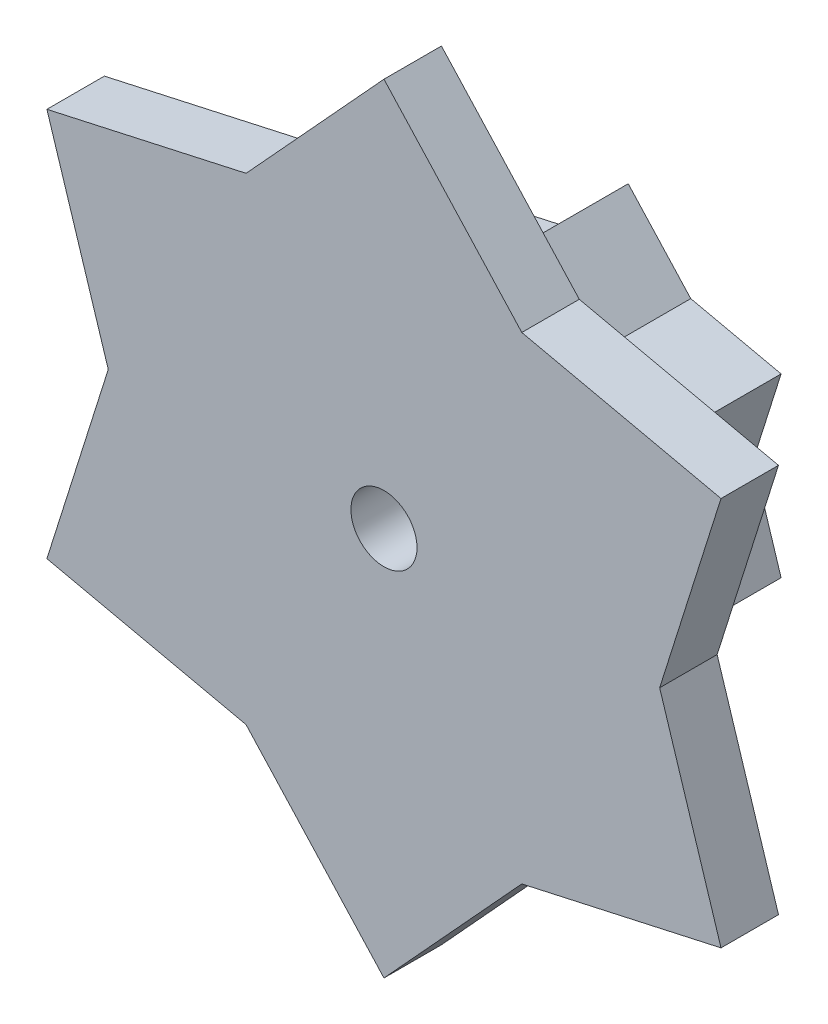
from build123d import *

# Parameters (mm, degrees)
BOSS_EXTRUDE1_DEPTH     = 6.5
BOSS_EXTRUDE2_DEPTH     = 2
CUT_EXTRUDE1_DEPTH      = 20.059283612
CUT_EXTRUDE1_DEPTH_BACK = 20.059283612
SKETCH1_4_R             = 1.15
CHAMFER1_SIZE           = 0.4


with BuildPart() as part:
    # Sketch1 → Boss-Extrude1 (new body)
    with BuildSketch(Plane.XY):
        Polygon((2.175697935, 3.768419365), (0, 6.142777017), (-2.175697935, 3.768419365), (-5.319800946, 3.071388508), (-4.351395869, 0), (-5.319800946, -3.071388508), (-2.175697935, -3.768419365), (0, -6.142777017), (2.175697935, -3.768419365), (5.319800946, -3.071388508), (4.351395869, 0), (5.319800946, 3.071388508), align=None)
    extrude(amount=-BOSS_EXTRUDE1_DEPTH)

    # Sketch2 → Boss-Extrude2 (add)
    with BuildSketch(Plane.XY):
        Polygon((11.729199677, 6.771856591), (4.797020748, 8.30868366), (0, 13.543713181), (-4.797020748, 8.30868366), (-11.729199677, 6.771856591), (-9.594041495, 0), (-11.729199677, -6.771856591), (-4.797020748, -8.30868366), (0, -13.543713181), (4.797020748, -8.30868366), (11.729199677, -6.771856591), (9.594041495, 0), align=None)
    extrude(amount=BOSS_EXTRUDE2_DEPTH)

    # Sketch1<4> → Cut-Extrude1 (cut, two sides: drawn at the far end of the back side and taken through both)
    with BuildSketch(Plane.XY.offset(-CUT_EXTRUDE1_DEPTH_BACK)):
        Circle(SKETCH1_4_R)
    extrude(amount=CUT_EXTRUDE1_DEPTH + CUT_EXTRUDE1_DEPTH_BACK, mode=Mode.SUBTRACT)

    # Chamfer1
    chamfer1_edges = [part.edges().sort_by_distance(p)[0] for p in [
        (3.74774944, -3.419903937, 0),
        (1.087848967, -4.955598191, 0),
        (-1.087848967, -4.955598191, 0),
        (-3.74774944, -3.419903937, 0),
        (-4.835598408, -1.535694254, 0),
        (-4.835598408, 1.535694254, 0),
        (-3.74774944, 3.419903937, 0),
        (4.835598408, -1.535694254, 0),
        (4.835598408, 1.535694254, 0),
        (3.74774944, 3.419903937, 0),
        (1.087848967, 4.955598191, 0),
        (-1.087848967, 4.955598191, 0),
    ]]
    chamfer(chamfer1_edges, length=CHAMFER1_SIZE)


solid = part.part
